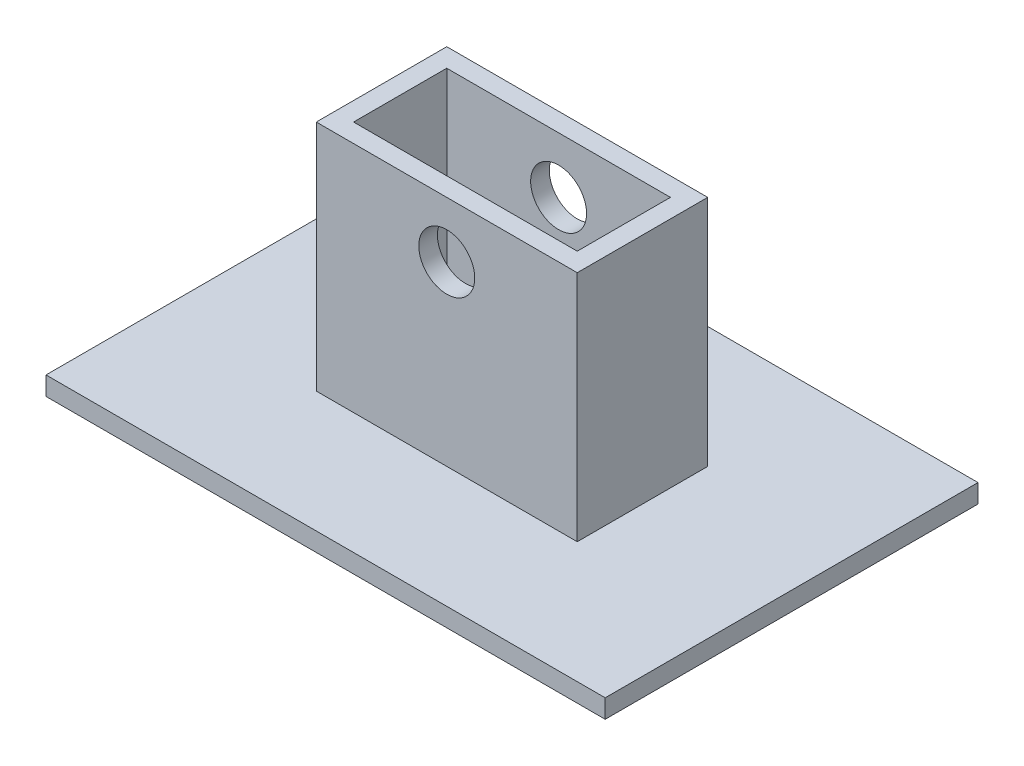
from build123d import *

# Parameters (mm, degrees)
SKETCH1_W           = 76.2
SKETCH1_H           = 50.8
BOSS_EXTRUDE1_DEPTH = 2.54
SKETCH2_W           = 35.56
SKETCH2_H           = 17.78
SKETCH2_W_2         = 30.48
SKETCH2_H_2         = 12.7
BOSS_EXTRUDE2_DEPTH = 31.75
SKETCH3_R           = 3.81
CUT_EXTRUDE1_DEPTH  = 31.75


with BuildPart() as part:
    # Sketch1 → Boss-Extrude1 (new body)
    with BuildSketch(Plane(origin=(0, 0, 0), x_dir=(1, 0, 0), z_dir=(0, 1, 0))):
        Rectangle(SKETCH1_W, SKETCH1_H)
    extrude(amount=BOSS_EXTRUDE1_DEPTH)

    # Sketch2 → Boss-Extrude2 (add)
    with BuildSketch(Plane(origin=(0, 2.54, 0), x_dir=(1, 0, 0), z_dir=(0, 1, 0))):
        Rectangle(SKETCH2_W, SKETCH2_H)
        Rectangle(SKETCH2_W_2, SKETCH2_H_2, mode=Mode.SUBTRACT)
    extrude(amount=BOSS_EXTRUDE2_DEPTH)

    # Sketch3 → Cut-Extrude1 (cut)
    with BuildSketch(Plane.XY.offset(8.89)):
        with Locations((0, 26.67)):
            Circle(SKETCH3_R)
    extrude(amount=-CUT_EXTRUDE1_DEPTH, mode=Mode.SUBTRACT)


solid = part.part
